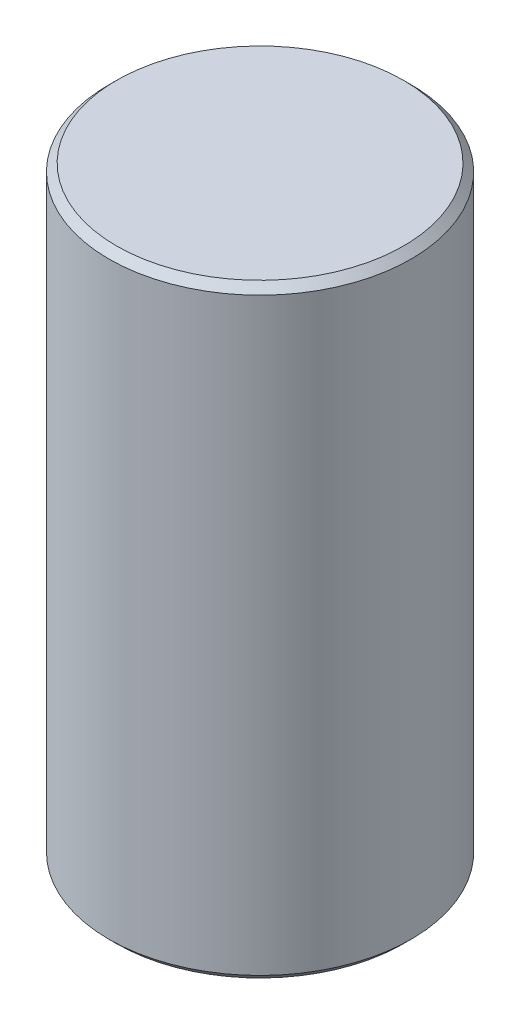
from build123d import *

# Parameters (mm, degrees)
SKETCH1_R           = 2.5
BOSS_EXTRUDE1_DEPTH = 5
CHAMFER1_SIZE       = 0.125


with BuildPart() as part:
    # Sketch1 → Boss-Extrude1 (new, symmetric)
    with BuildSketch(Plane(origin=(0, 0, 0), x_dir=(1, 0, 0), z_dir=(0, 1, 0))):
        with Locations(Location((0, 0, 0), (0, 0, 270))):
            Circle(SKETCH1_R)
    extrude(amount=BOSS_EXTRUDE1_DEPTH, both=True)

    # Chamfer1
    chamfer1_edges = [part.edges().sort_by_distance(p)[0] for p in [
        (0, -5, -2.5),
        (0, 5, -2.5),
    ]]
    chamfer(chamfer1_edges, length=CHAMFER1_SIZE)


solid = part.part
